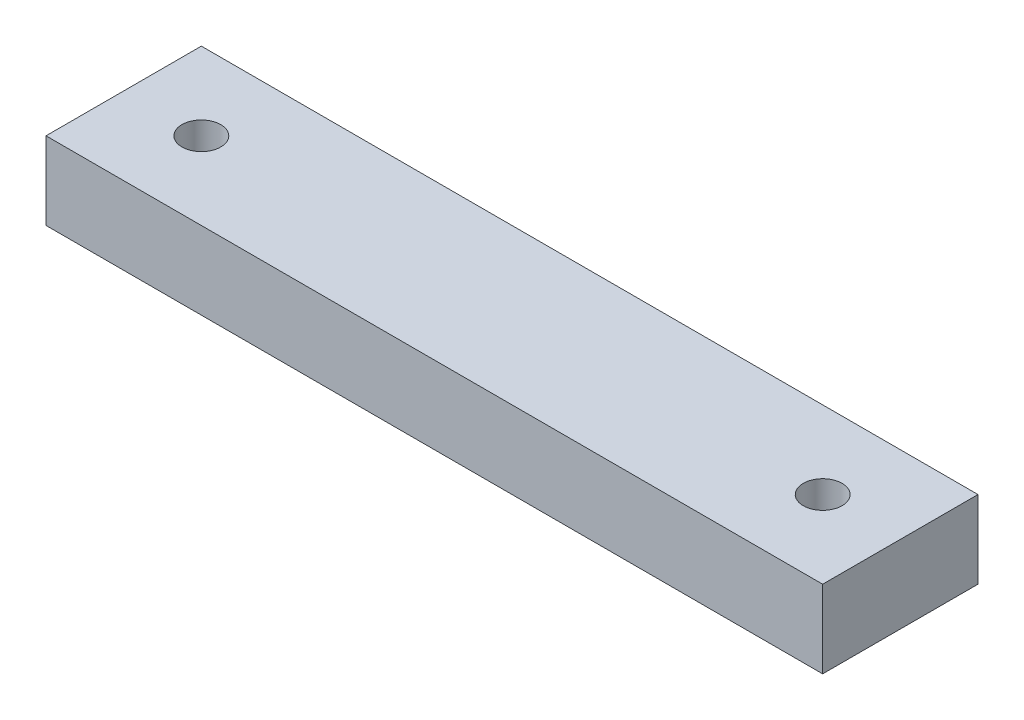
from build123d import *

# Parameters (mm, degrees)
SKETCH_1_W      = 100
SKETCH_1_H      = 20
SKETCH_1_R      = 2.5
EXTRUDE_1_DEPTH = 10


with BuildPart() as part:
    # 草图1 → 凸台-拉伸1 (new body)
    with BuildSketch(Plane(origin=(0, 0, 0), x_dir=(1, 0, 0), z_dir=(0, 1, 0))):
        Rectangle(SKETCH_1_W, SKETCH_1_H)
        with Locations(Location((-40, 0, 0), (0, 0, 270))):
            Circle(SKETCH_1_R, mode=Mode.SUBTRACT)
        with Locations(Location((40, 0, 0), (0, 0, 270))):
            Circle(SKETCH_1_R, mode=Mode.SUBTRACT)
    extrude(amount=EXTRUDE_1_DEPTH)


solid = part.part
